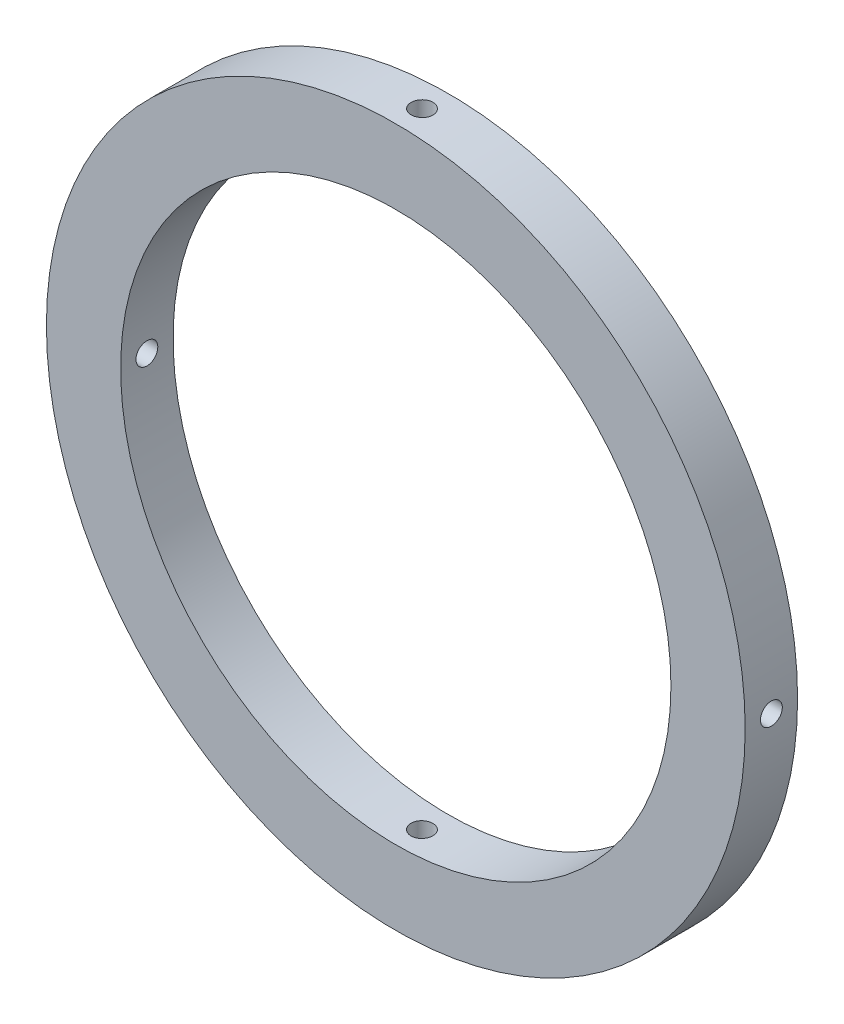
from build123d import *

# Parameters (mm, degrees)
SKETCH1_R               = 40
SKETCH1_R_2             = 31.5
BOSS_EXTRUDE1_DEPTH     = 6
CUT_EXTRUDE1_REACH      = 91.644
CUT_EXTRUDE1_END_RADIUS = 31.5
SKETCH2_R               = 1.25
CIRPATTERN1_COUNT       = 4


with BuildPart() as part:
    # Sketch1 → Boss-Extrude1 (new body)
    with BuildSketch(Plane.XY):
        Circle(SKETCH1_R)
        Circle(SKETCH1_R_2, mode=Mode.SUBTRACT)
    extrude(amount=BOSS_EXTRUDE1_DEPTH)

    # Cut-Extrude1: up to this cylinder (the profile starts outside it)
    cut_extrude1_end = Plane(origin=(0, 0, 3), z_dir=(0, 0, -1)) * Cylinder(CUT_EXTRUDE1_END_RADIUS, 247.288, mode=Mode.PRIVATE)
    # Sketch2 → Cut-Extrude1 (cut, up to the surface)
    with BuildSketch(Plane(origin=(0, 40, 0), x_dir=(1, 0, 0), z_dir=(0, 1, 0)), mode=Mode.PRIVATE) as cut_extrude1_sk1:
        with Locations(Location((0, -3, 0), (0, 0, 270))):
            Circle(SKETCH2_R)
    cut_extrude1_tool1 = extrude(cut_extrude1_sk1.sketch, amount=-CUT_EXTRUDE1_REACH, mode=Mode.PRIVATE) - cut_extrude1_end
    cut_extrude1 = cut_extrude1_tool1.solids().sort_by_distance((0, 40, 3))[0]
    add(cut_extrude1, mode=Mode.SUBTRACT)

    # CirPattern1: Cut-Extrude1 ×4 about axis
    cirpattern1_axis = Axis((0, 0, 6), (0, 0, -1))
    for i in range(1, CIRPATTERN1_COUNT):
        add(cut_extrude1.rotate(cirpattern1_axis, i * 360 / CIRPATTERN1_COUNT), mode=Mode.SUBTRACT)


solid = part.part
